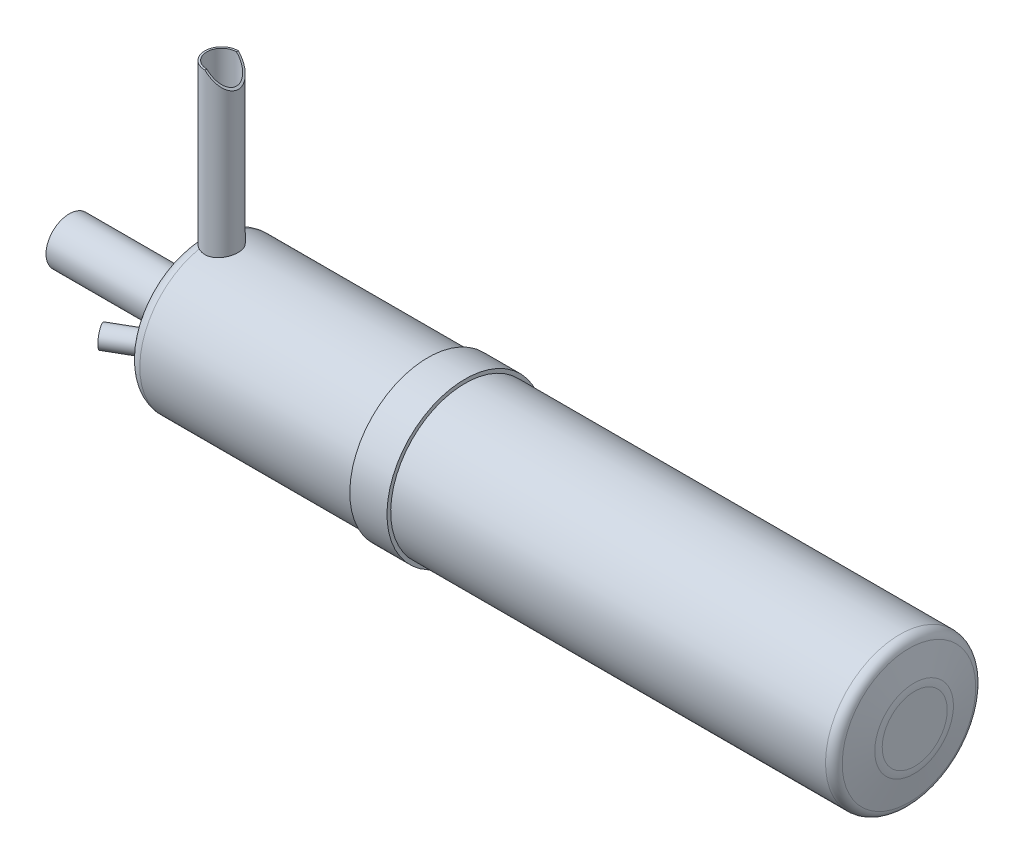
from build123d import *

# Parameters (mm, degrees)
SKETCH2_W          = 1
SKETCH2_H          = 88
CUT_EXTRUDE1_DEPTH = 10


with BuildPart() as part:
    # Sketch1 → Revolve1 (revolve)
    with BuildSketch(Plane.XY, mode=Mode.PRIVATE) as revolve1_sk:
        with BuildLine():
            Line((0, 12.5), (70, 12.5))
            Line((70, 12.5), (70, 16.864606255))
            ThreePointArc((70, 16.864606255), (70.010085496, 17.499679587), (70.040331814, 18.134112416))
            Line((70.040331814, 18.134112416), (71.014116135, 33.444327156))
            ThreePointArc((71.014116135, 33.444327156), (73.209921196, 38.104424066), (78, 40))
            Line((78, 40), (193, 40))
            Line((193, 40), (193, 42))
            Line((193, 42), (213, 42))
            Line((213, 42), (213, 40))
            Line((213, 40), (447, 40))
            ThreePointArc((447, 40), (450.195681655, 38.845467301), (451.915555723, 35.915047504))
            Line((451.915555723, 35.915047504), (454.662222892, 21.160190017))
            ThreePointArc((454.662222892, 21.160190017), (454.915376695, 19.337871346), (455, 17.5))
            Line((455, 17.5), (455, 0))
            Line((455, 0), (453, 0))
            Line((453, 0), (453, 17.5))
            ThreePointArc((453, 17.5), (452.923839026, 19.154084211), (452.696000602, 20.794171015))
            Line((452.696000602, 20.794171015), (449.949333434, 35.549028503))
            ThreePointArc((449.949333434, 35.549028503), (448.917408993, 37.30728038), (447, 38))
            Line((447, 38), (78, 38))
            ThreePointArc((78, 38), (74.57851514, 36.64601719), (73.010082953, 33.31737654))
            Line((73.010082953, 33.31737654), (72.036298632, 18.0071618))
            ThreePointArc((72.036298632, 18.0071618), (72.009076947, 17.436172254), (72, 16.864606255))
            Line((72, 16.864606255), (72, 10.5))
            Line((72, 10.5), (0, 10.5))
            Line((0, 10.5), (0, 12.5))
        make_face()
    revolve(revolve1_sk.sketch.rotate(Axis((0, 0, 0), (1, 0, 0)), 180), axis=Axis((0, 0, 0), (1, 0, 0)))

    # Sketch2 → Revolve2 (revolve)
    with BuildSketch(Plane.XY, mode=Mode.PRIVATE) as revolve2_sk:
        with Locations((73.514116135, 81)):
            Rectangle(SKETCH2_W, SKETCH2_H)
    revolve(revolve2_sk.sketch.rotate(Axis((82.014116135, 37, 0), (0, 1, 0)), 270), axis=Axis((82.014116135, 37, 0), (0, 1, 0)))

    # Sketch3 → Cut-Extrude1 (cut, symmetric)
    with BuildSketch(Plane.XY):
        Polygon((82.014116135, 125), (91.014116135, 125), (91.014116135, 116), align=None)
    extrude(amount=CUT_EXTRUDE1_DEPTH, both=True, mode=Mode.SUBTRACT)

    # Sketch4 → Revolve3 (revolve)
    with BuildSketch(Plane(origin=(0, 0, 0), x_dir=(1, 0, 0), z_dir=(0, 1, 0))):
        Polygon((74.509274782, -28.686334103), (55.456715899, -39.686334103), (55.956715899, -40.552359507), (75.009274782, -29.552359507), align=None)
    revolve(axis=Axis((53.206715899, 0, 35.789219786), (0.8660254037844379, 0, -0.5000000000000013)))


solid = part.part
